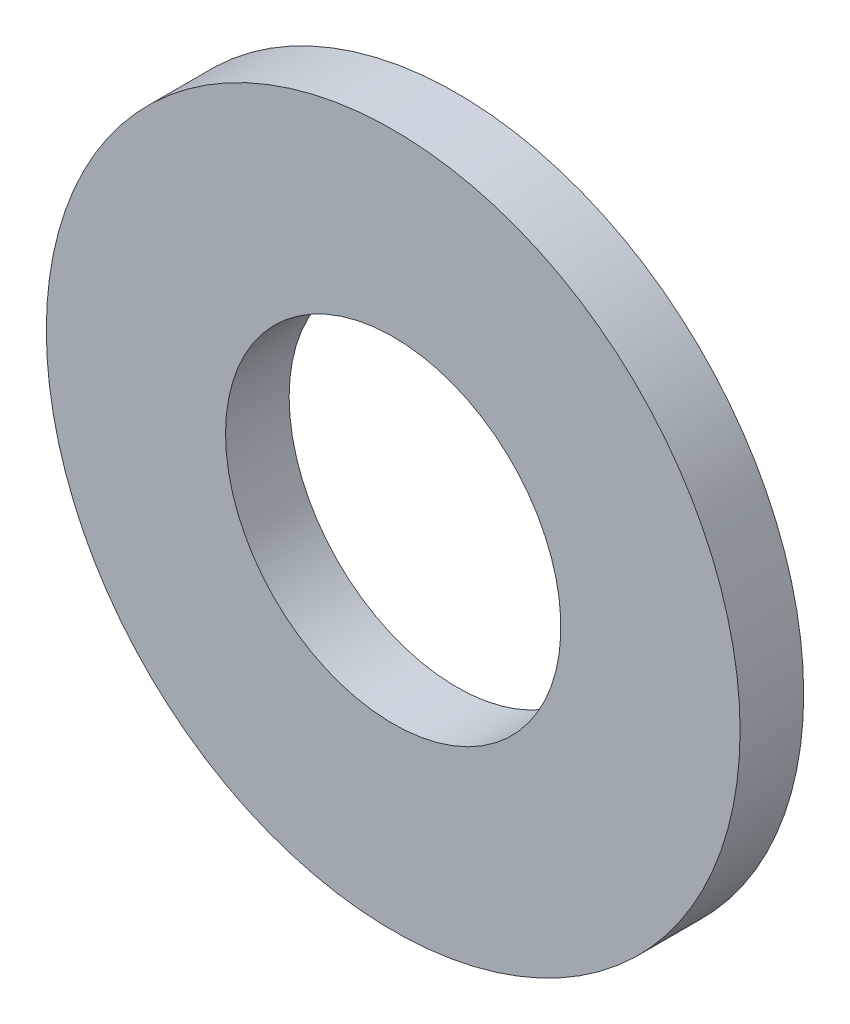
from build123d import *

# Parameters (mm, degrees)
BOSS_EXTRUDE1_DEPTH      = 0.275
BOSS_EXTRUDE1_DEPTH_BACK = 0.275
SKETCH3_R                = 3
SKETCH3_R_2              = 1.45


with BuildPart() as part:
    # Sketch3 → Boss-Extrude1 (new, two sides: drawn at the far end of the back side and taken through both)
    with BuildSketch(Plane.XY.offset(-BOSS_EXTRUDE1_DEPTH_BACK)):
        with Locations(Location((0, 0, 0), (0, 0, 180))):
            Circle(SKETCH3_R)
        with Locations(Location((0, 0, 0), (0, 0, 180))):
            Circle(SKETCH3_R_2, mode=Mode.SUBTRACT)
    extrude(amount=BOSS_EXTRUDE1_DEPTH + BOSS_EXTRUDE1_DEPTH_BACK)


solid = part.part
